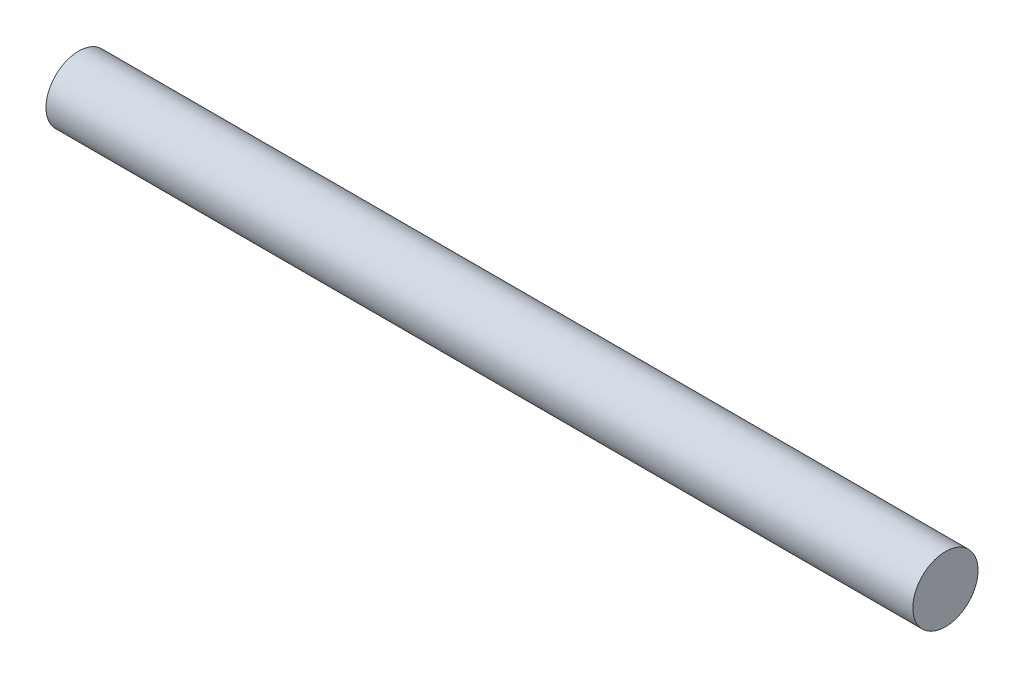
from build123d import *

# Parameters (mm, degrees)
SKETCH1_R           = 2.5
BOSS_EXTRUDE1_DEPTH = 66.4


with BuildPart() as part:
    # Sketch1 → Boss-Extrude1 (new body)
    with BuildSketch(Plane(origin=(0, 0, 0), x_dir=(0, 0, -1), z_dir=(1, 0, 0))):
        with Locations(Location((0, 0, 0), (0, 0, 180))):
            Circle(SKETCH1_R)
    extrude(amount=BOSS_EXTRUDE1_DEPTH)


solid = part.part
